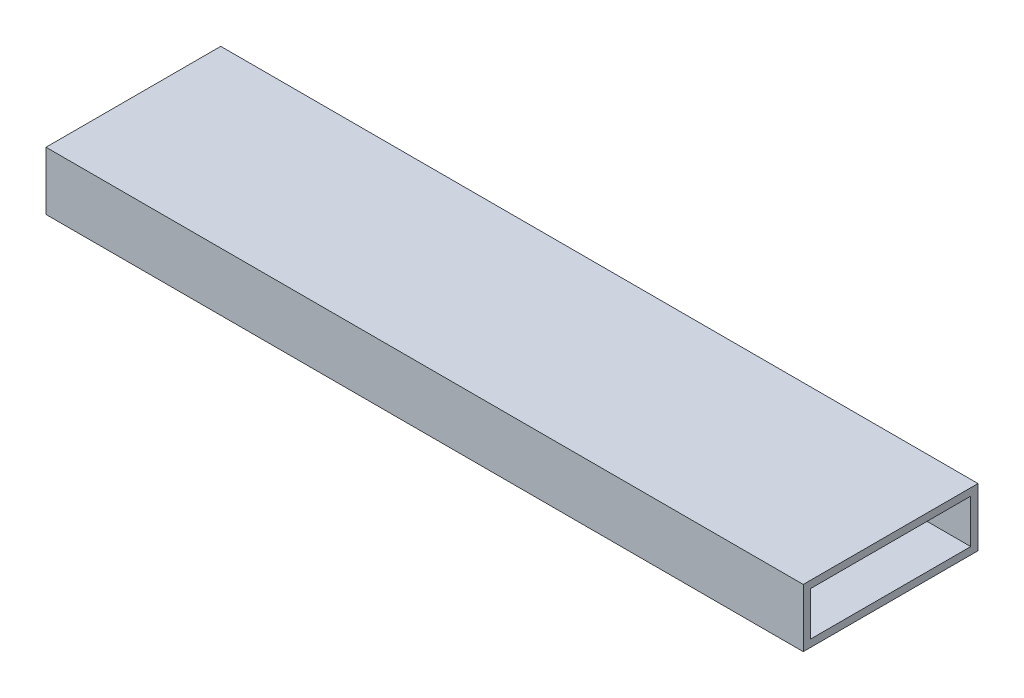
from build123d import *

# Parameters (mm, degrees)
SKETCH1_W           = 76.2
SKETCH1_H           = 25.4
BOSS_EXTRUDE1_DEPTH = 330.2
SKETCH2_W           = 69.85
SKETCH2_H           = 19.05
CUT_EXTRUDE1_DEPTH  = 339.979717873


with BuildPart() as part:
    # Sketch1 → Boss-Extrude1 (new body)
    with BuildSketch(Plane(origin=(0, 0, 0), x_dir=(0, 0, -1), z_dir=(1, 0, 0))):
        with Locations((36.067245715, 6.650162585)):
            Rectangle(SKETCH1_W, SKETCH1_H)
    extrude(amount=BOSS_EXTRUDE1_DEPTH)

    # Sketch2 → Cut-Extrude1 (cut, through all)
    with BuildSketch(Plane.ZY):
        with Locations((-36.067245715, 6.650162585)):
            Rectangle(SKETCH2_W, SKETCH2_H)
    extrude(amount=-CUT_EXTRUDE1_DEPTH, mode=Mode.SUBTRACT)


solid = part.part
